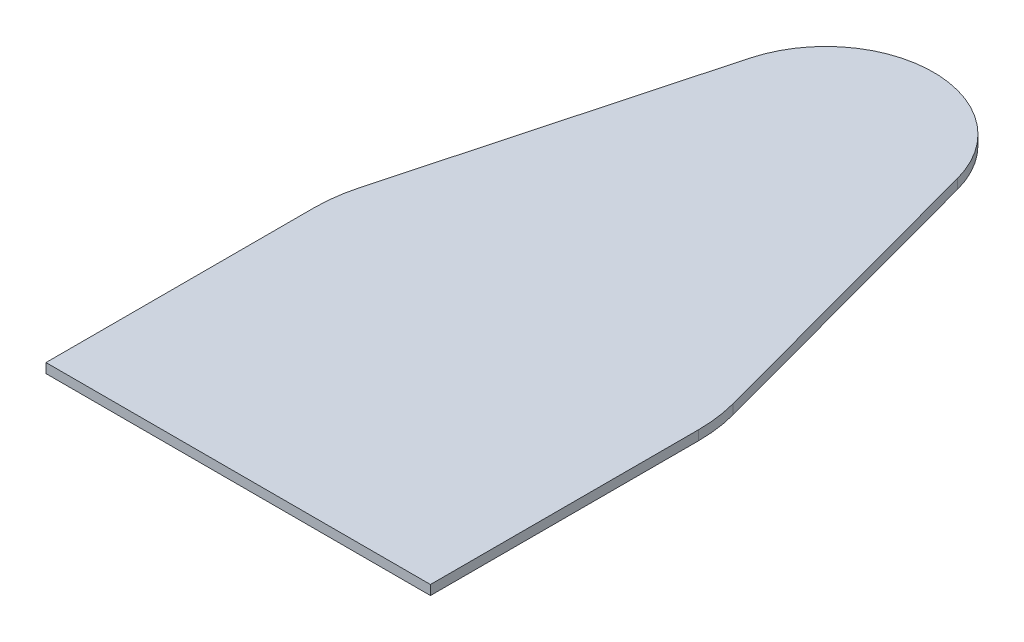
from build123d import *

# Parameters (mm, degrees)
BOSS_EXTRUDE2_DEPTH = 3.175


with BuildPart() as part:
    # Sketch1 → Boss-Extrude2 (new body)
    with BuildSketch(Plane(origin=(0, 0, 0), x_dir=(1, 0, 0), z_dir=(0, 1, 0))):
        with BuildLine():
            Line((0, 0), (127, 0))
            Line((127, 0), (127, 88.516943855))
            ThreePointArc((127, 88.516943855), (126.559592816, 95.191628223), (125.246007425, 101.750581135))
            Line((125.246007425, 101.750581135), (97.832205198, 203.350581135))
            ThreePointArc((97.832205198, 203.350581135), (63.5, 229.647035039), (29.167794802, 203.350581135))
            Line((29.167794802, 203.350581135), (1.753992575, 101.750581135))
            ThreePointArc((1.753992575, 101.750581135), (0.440407184, 95.191628223), (0, 88.516943855))
            Line((0, 88.516943855), (0, 0))
        make_face()
    extrude(amount=BOSS_EXTRUDE2_DEPTH)


solid = part.part
